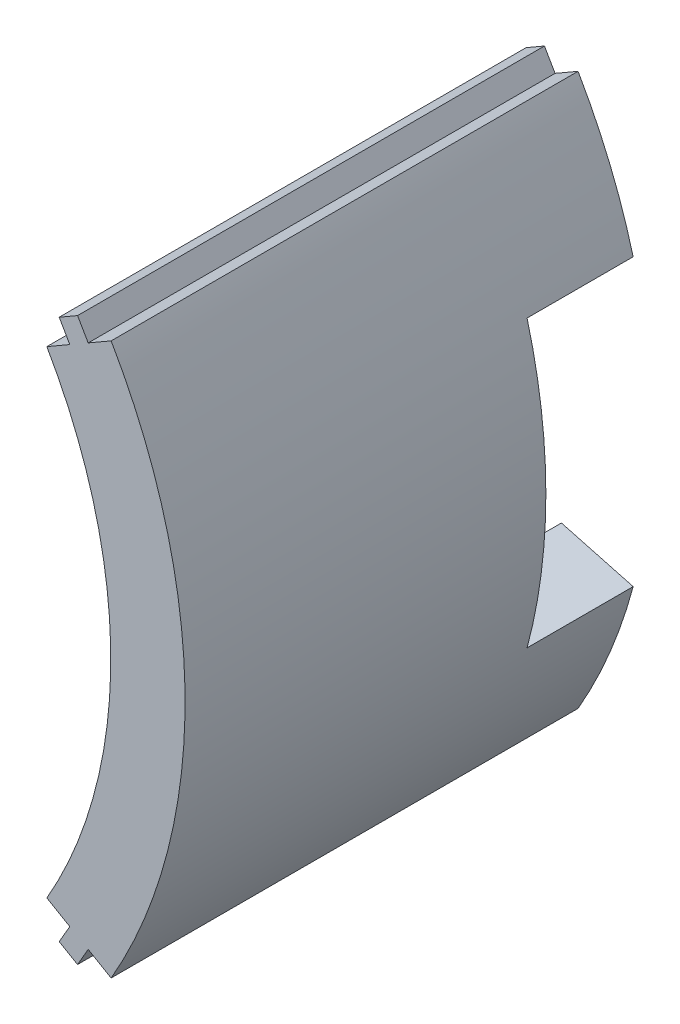
from build123d import *

# Parameters (mm, degrees)
EXTRUDE_1_DEPTH     = 22
SKETCH_4_W          = 1
SKETCH_4_H          = 22
EXTRUDE_2_DEPTH     = 1
SKETCH_2_W          = 1
SKETCH_2_H          = 22
EXTRUDE_3_DEPTH     = 1
CUT_EXTRUDE_2_DEPTH = 5


with BuildPart() as part:
    # Эскиз1 → Бобышка-Вытянуть1 (new body)
    with BuildSketch(Plane.XY):
        with BuildLine():
            Line((19.485571585, 11.25), (22.516660498, 13))
            ThreePointArc((22.516660498, 13), (26, 0), (22.516660498, -13))
            Line((22.516660498, -13), (19.485571585, -11.25))
            ThreePointArc((19.485571585, -11.25), (22.5, 0), (19.485571585, 11.25))
        make_face()
    extrude(amount=EXTRUDE_1_DEPTH)

    # Эскиз4 → Бобышка-Вытянуть2 (add)
    with BuildSketch(Plane(origin=(0, 0, 0), x_dir=(-0.866025403784438, -0.5000000000000012, 0), z_dir=(-0.5000000000000011, 0.8660254037844379, 0))):
        with Locations((-24.25, 11)):
            Rectangle(SKETCH_4_W, SKETCH_4_H)
    extrude(amount=EXTRUDE_2_DEPTH)

    # Эскиз2 → Бобышка-Вытянуть3 (add)
    with BuildSketch(Plane(origin=(0, 0, 0), x_dir=(0.866025403784438, -0.5000000000000012, 0), z_dir=(-0.5000000000000011, -0.8660254037844379, 0))):
        with Locations((24.25, 11)):
            Rectangle(SKETCH_2_W, SKETCH_2_H)
    extrude(amount=EXTRUDE_3_DEPTH)

    # Эскиз6 → Вырез-Вытянуть2 (cut)
    with BuildSketch(Plane(origin=(0, 0, 0), x_dir=(-1, 0, 0), z_dir=(0, 0, -1))):
        with BuildLine():
            Line((-21.733331092, 5.823428515), (-25.114071484, 6.729295173))
            ThreePointArc((-25.114071484, 6.729295173), (-26, 0), (-25.114071484, -6.729295173))
            Line((-25.114071484, -6.729295173), (-21.733331092, -5.823428515))
            ThreePointArc((-21.733331092, -5.823428515), (-22.5, 0), (-21.733331092, 5.823428515))
        make_face()
    extrude(amount=-CUT_EXTRUDE_2_DEPTH, mode=Mode.SUBTRACT)


solid = part.part
